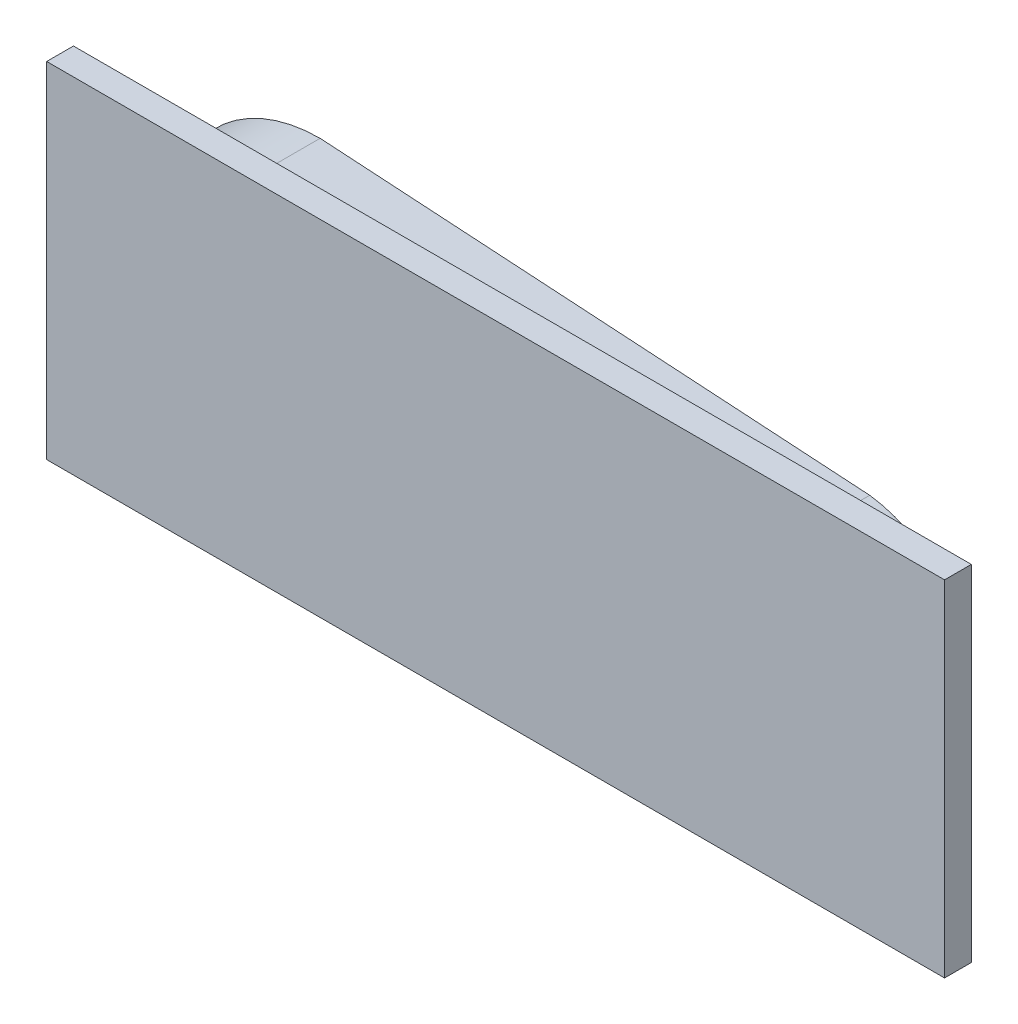
from build123d import *

# Parameters (mm, degrees)
BOSS_EXTRUDE1_DEPTH = 2
SKETCH2_W           = 33.530667502
SKETCH2_H           = 12.876796265
BOSS_EXTRUDE2_DEPTH = 1


with BuildPart() as part:
    # Sketch1 → Boss-Extrude1 (new body)
    with BuildSketch(Plane(origin=(0, 0, 0), x_dir=(-1, 0, 0), z_dir=(0, 0, 1))):
        with BuildLine():
            Line((4.419624532, 5.457754962), (-15.163378573, 4.241831176))
            ThreePointArc((-15.163378573, 4.241831176), (-19.147983311, 0.130911389), (-15.424074318, -4.217564002))
            Line((-15.424074318, -4.217564002), (-14.905016784, -4.249997039))
            Line((-14.905016784, -4.249997039), (4.41534389, -5.457219623))
            Line((4.41534389, -5.457219623), (5.1, -5.5))
            ThreePointArc((5.1, -5.5), (10.6, 0), (5.1, 5.5))
            Line((5.1, 5.5), (4.419624532, 5.457754962))
        make_face()
        with BuildLine():
            Line((-14.9, 2.25), (4.880474733, 3.493108738))
            ThreePointArc((4.880474733, 3.493108738), (8.6, 0), (4.880474733, -3.493108738))
            Line((4.880474733, -3.493108738), (-14.9, -2.25))
            ThreePointArc((-14.9, -2.25), (-17.15, 0), (-14.9, 2.25))
        make_face(mode=Mode.SUBTRACT)
    extrude(amount=BOSS_EXTRUDE1_DEPTH)

    # Sketch2 → Boss-Extrude2 (add)
    with BuildSketch(Plane.XY.offset(2)):
        with Locations((4.453710744, -0.558629325)):
            Rectangle(SKETCH2_W, SKETCH2_H)
    extrude(amount=BOSS_EXTRUDE2_DEPTH)


solid = part.part
